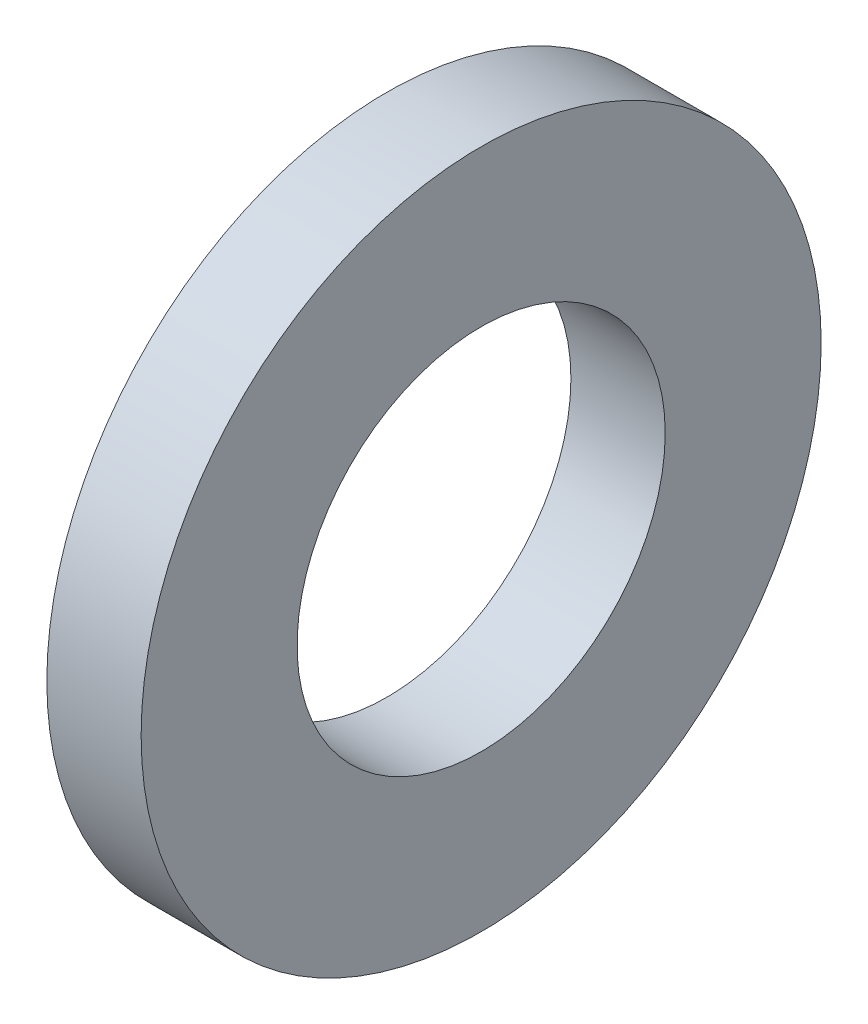
from build123d import *

# Parameters (mm, degrees)
SKETCH1_R           = 4.7625
SKETCH1_R_2         = 2.5781
BOSS_EXTRUDE1_DEPTH = 1.3208


with BuildPart() as part:
    # Sketch1 → Boss-Extrude1 (new body)
    with BuildSketch(Plane(origin=(0, 0, 0), x_dir=(0, 0, -1), z_dir=(1, 0, 0))):
        Circle(SKETCH1_R)
        Circle(SKETCH1_R_2, mode=Mode.SUBTRACT)
    extrude(amount=BOSS_EXTRUDE1_DEPTH)


solid = part.part
